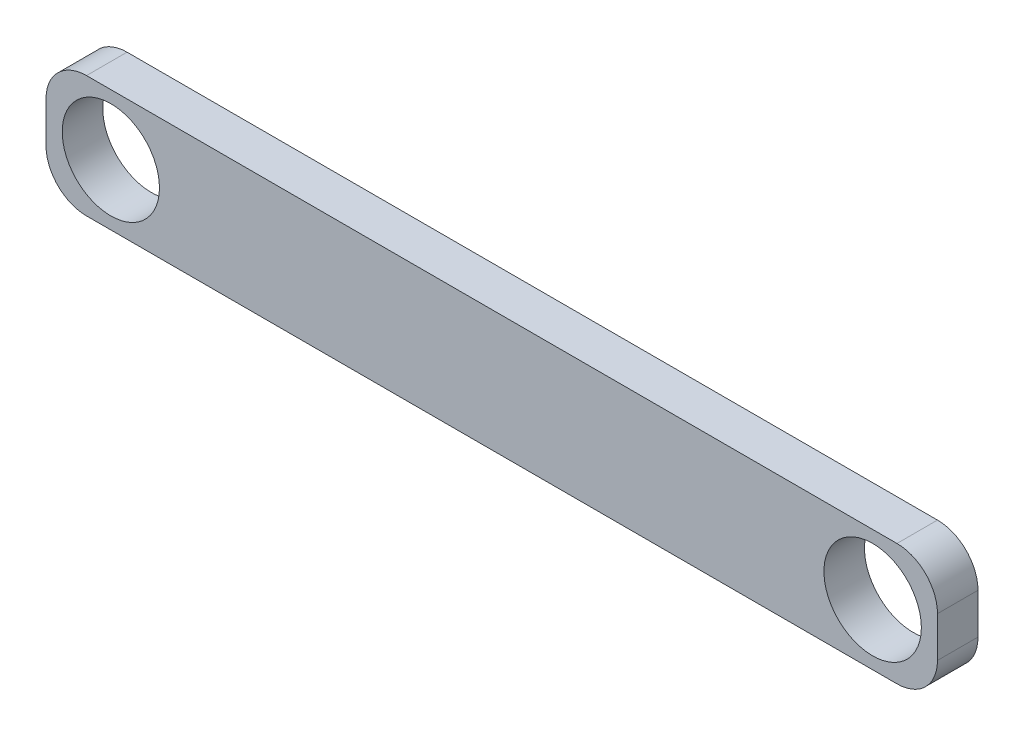
from build123d import *

# Parameters (mm, degrees)
EXTRUDE_1_DEPTH = 5


with BuildPart() as part:
    # 草图1 → 凸台-拉伸1 (new body)
    with BuildSketch(Plane.XY):
        with BuildLine():
            Line((95.989328864, 7.5), (14, 7.5))
            ThreePointArc((14, 7.5), (11, 2.303847577), (5, 2.303847577))
            Line((5, 2.303847577), (5, 0))
            Line((5, 0), (105, 0))
            Line((105, 0), (105, 2.291529254))
            ThreePointArc((105, 2.291529254), (98.991997831, 2.296146576), (95.989328864, 7.5))
        make_face()
        with BuildLine():
            ThreePointArc((5, 2.303847577), (2.803847577, 4.5), (2, 7.5))
            Line((2, 7.5), (0, 7.5))
            Line((0, 7.5), (0, 5))
            ThreePointArc((0, 5), (1.464466094, 1.464466094), (5, 0))
            Line((5, 0), (5, 2.303847577))
        make_face()
        with BuildLine():
            Line((5, 12.696152423), (5, 15))
            ThreePointArc((5, 15), (1.464466094, 13.535533906), (0, 10))
            Line((0, 10), (0, 7.5))
            Line((0, 7.5), (2, 7.5))
            ThreePointArc((2, 7.5), (2.803847577, 10.5), (5, 12.696152423))
        make_face()
        with BuildLine():
            Line((105, 15), (5, 15))
            Line((5, 15), (5, 12.696152423))
            ThreePointArc((5, 12.696152423), (11, 12.696152423), (14, 7.5))
            Line((14, 7.5), (95.989328864, 7.5))
            ThreePointArc((95.989328864, 7.5), (98.991997831, 12.703853424), (105, 12.708470746))
            Line((105, 12.708470746), (105, 15))
        make_face()
        with BuildLine():
            ThreePointArc((110, 10), (108.535533906, 13.535533906), (105, 15))
            Line((105, 15), (105, 12.708470746))
            ThreePointArc((105, 12.708470746), (107.203853424, 10.508002169), (108.010671136, 7.5))
            Line((108.010671136, 7.5), (110, 7.5))
            Line((110, 7.5), (110, 10))
        make_face()
        with BuildLine():
            Line((110, 7.5), (108.010671136, 7.5))
            ThreePointArc((108.010671136, 7.5), (107.203853424, 4.491997831), (105, 2.291529254))
            Line((105, 2.291529254), (105, 0))
            ThreePointArc((105, 0), (108.535533906, 1.464466094), (110, 5))
            Line((110, 5), (110, 7.5))
        make_face()
    extrude(amount=EXTRUDE_1_DEPTH)


solid = part.part
